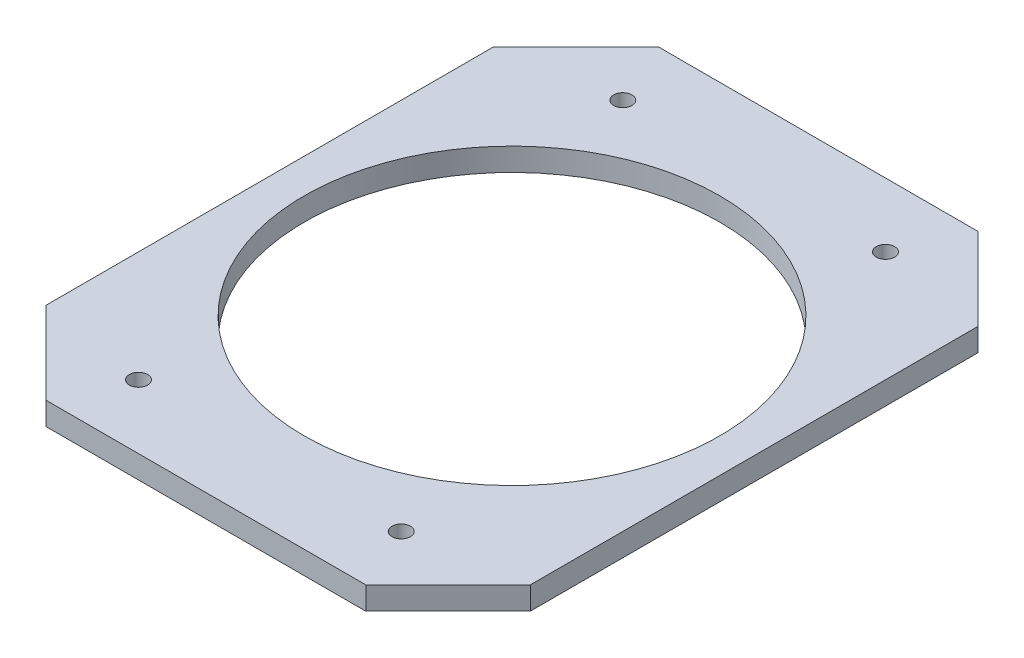
from build123d import *

# Parameters (mm, degrees)
BOSS_EXTRUDE1_DEPTH    = 6.35
F_10_CLEARANCE_HOLE1_D = 5.1054
CIRPATTERN1_COUNT      = 2
SKETCH4_R              = 57.785
CUT_EXTRUDE1_DEPTH     = 109.679651729


with BuildPart() as part:
    # Sketch1 → Boss-Extrude1 (new body)
    with BuildSketch(Plane(origin=(0, 0, 0), x_dir=(1, 0, 0), z_dir=(0, 1, 0))):
        Polygon((-67.31, 62.23), (-44.45, 85.09), (44.45, 85.09), (67.31, 62.23), (67.31, -62.23), (44.45, -85.09), (-44.45, -85.09), (-67.31, -62.23), align=None)
    extrude(amount=BOSS_EXTRUDE1_DEPTH)

    # #10 Clearance Hole1 (through all)
    with Locations(Plane(origin=(0, 6.35, 0), x_dir=(-1, 0, 0), z_dir=(0, 1, 0))):
        with Locations((36.5125, -67.31), (-36.5125, -67.31)):
            f_10_clearance_hole1 = Hole(F_10_CLEARANCE_HOLE1_D / 2)

    # CirPattern1: #10 Clearance Hole1 ×2 about axis
    cirpattern1_axis = Axis((0, 0, 0), (0, 1, 0))
    for i in range(1, CIRPATTERN1_COUNT):
        add(f_10_clearance_hole1.rotate(cirpattern1_axis, i * 360 / CIRPATTERN1_COUNT), mode=Mode.SUBTRACT)

    # Sketch4 → Cut-Extrude1 (cut, through all)
    with BuildSketch(Plane(origin=(0, 6.35, 0), x_dir=(1, 0, 0), z_dir=(0, 1, 0))):
        Circle(SKETCH4_R)
    extrude(amount=-CUT_EXTRUDE1_DEPTH, mode=Mode.SUBTRACT)


solid = part.part
